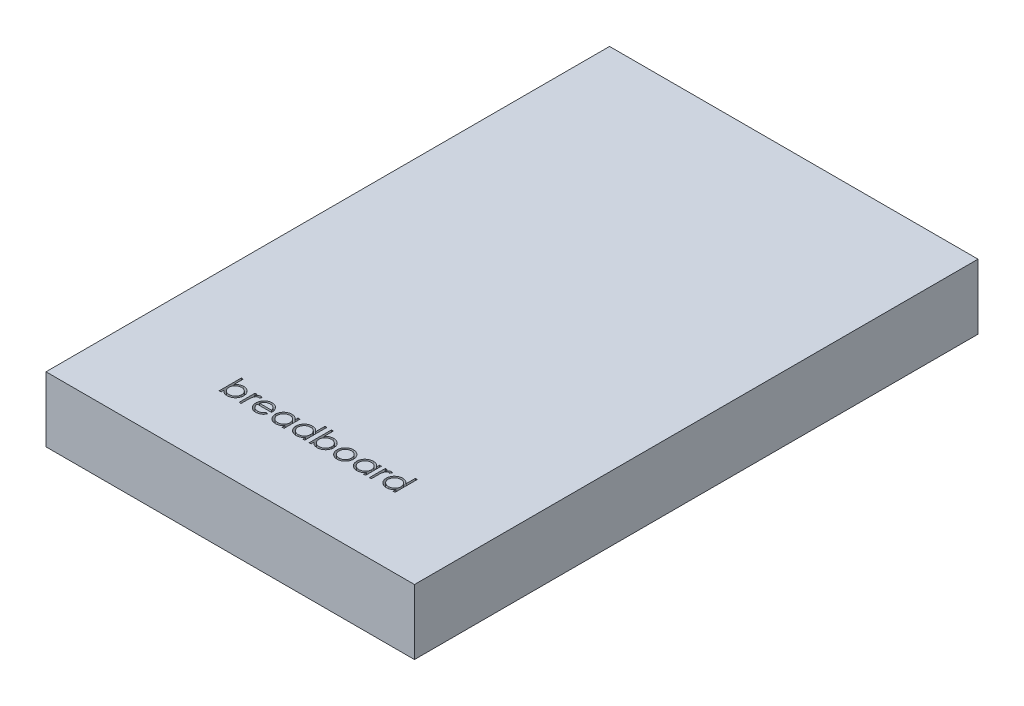
from build123d import *

# Parameters (mm, degrees)
SKETCH1_W           = 53.975
SKETCH1_H           = 82.55
BOSS_EXTRUDE1_DEPTH = 9.525
CUT_EXTRUDE1_DEPTH  = 1.905


with BuildPart() as part:
    # Sketch1 → Boss-Extrude1 (new body)
    with BuildSketch(Plane(origin=(0, 0, 0), x_dir=(1, 0, 0), z_dir=(0, 1, 0))):
        with Locations((26.9875, 41.275)):
            Rectangle(SKETCH1_W, SKETCH1_H)
    extrude(amount=BOSS_EXTRUDE1_DEPTH)

    # Sketch2 → Cut-Extrude1 (cut)
    # profile 1 of 10: a face of its own
    with BuildSketch(Plane(origin=(0, 9.525, 0), x_dir=(1, 0, 0), z_dir=(0, 1, 0))):
        with BuildLine():
            Line((15.092649327, 10.264986523), (15.092649327, 13.52139678))
            Line((15.092649327, 13.52139678), (15.377585225, 13.52139678))
            Line((15.377585225, 13.52139678), (15.377585225, 12.164135161))
            add(Edge.make_bspline(
                [(15.377585225, 12.164135161), (15.409692112, 12.201108428), (15.472333973, 12.273244796), (15.577359753, 12.367449449), (15.687491949, 12.447325625), (15.803568366, 12.513171604), (15.925754099, 12.563312662), (16.053418226, 12.599981544), (16.186887098, 12.622103949), (16.27789092, 12.624613173), (16.323979456, 12.625883959)],
                knots=[0, 0, 0, 0, 1.077089805, 2.101446609, 3.097517232, 4.067117542, 5.031729543, 5.997785507, 6.985986182, 8, 8, 8, 8], degree=3))
            add(Edge.make_bspline(
                [(16.323979456, 12.625883959), (16.364951595, 12.624758895), (16.445960497, 12.622534452), (16.565052159, 12.605630302), (16.679636344, 12.578218439), (16.789650682, 12.540216248), (16.894581831, 12.489794547), (16.995328261, 12.429432075), (17.091373811, 12.357551591), (17.181230743, 12.27536598), (17.26404734, 12.186142472), (17.336539403, 12.090728901), (17.39777127, 11.990512212), (17.448418228, 11.885827869), (17.487580541, 11.776248322), (17.514561026, 11.661881013), (17.531700097, 11.542838454), (17.53385932, 11.461818982), (17.53495702, 11.420630554)],
                knots=[0, 0, 0, 0, 1.034377878, 2.045141349, 3.03070803, 4.00595497, 4.978199603, 5.965204761, 6.967410914, 8.002051993, 9.036360596, 10.037508045, 11.022711142, 11.997267194, 12.969246472, 13.954813154, 14.960274251, 16, 16, 16, 16], degree=3))
            add(Edge.make_bspline(
                [(17.53495702, 11.420630554), (17.533835392, 11.380081252), (17.531623717, 11.300124415), (17.514731531, 11.182462039), (17.486840276, 11.069215505), (17.446961203, 10.960677443), (17.396828009, 10.85633795), (17.334134208, 10.75738644), (17.26173423, 10.662101084), (17.177976689, 10.573542504), (17.087340823, 10.49168792), (16.990354331, 10.420562599), (16.889460159, 10.359133497), (16.783085764, 10.310460341), (16.672806184, 10.271089506), (16.55743994, 10.243768457), (16.437639726, 10.227827186), (16.356251877, 10.225472636), (16.315075209, 10.224281395)],
                knots=[0, 0, 0, 0, 1.024244038, 2.01964794, 2.996620209, 3.965911562, 4.936179293, 5.91563013, 6.920572822, 7.955171681, 8.990768464, 10.002129126, 10.989675881, 11.969873457, 12.952483066, 13.943799762, 14.959703725, 16, 16, 16, 16], degree=3))
            add(Edge.make_bspline(
                [(16.315075209, 10.224281395), (16.267935428, 10.225588233), (16.175502538, 10.228150713), (16.040290478, 10.249395073), (15.912309358, 10.285555248), (15.790101296, 10.334143412), (15.67541329, 10.399937262), (15.567517191, 10.481540886), (15.467093417, 10.580298931), (15.407932449, 10.655647568), (15.377585225, 10.694298422)],
                knots=[0, 0, 0, 0, 1.035807596, 2.031038093, 2.998900396, 3.954262848, 4.914341711, 5.895762244, 6.92060972, 8, 8, 8, 8], degree=3))
            Line((15.377585225, 10.694298422), (15.377585225, 10.264986523))
            Line((15.377585225, 10.264986523), (15.092649327, 10.264986523))
        make_face()
        with BuildLine():
            add(Edge.make_bspline(
                [(16.312531138, 10.509217293), (16.354182015, 10.510699227), (16.436394221, 10.513624331), (16.557083946, 10.536460403), (16.672576121, 10.574455278), (16.782288774, 10.626419785), (16.884505008, 10.691754059), (16.975811326, 10.770808085), (17.056982205, 10.861070174), (17.12470203, 10.962882167), (17.181240838, 11.07124126), (17.220078595, 11.185227662), (17.246131485, 11.301790792), (17.248718928, 11.380844704), (17.250021122, 11.420630554)],
                knots=[0, 0, 0, 0, 1.031910345, 2.036826888, 3.032245421, 4.038315463, 5.03827337, 6.029480047, 7.023177075, 8.037597977, 9.052889626, 10.043399556, 11.015292101, 12, 12, 12, 12], degree=3))
            add(Edge.make_bspline(
                [(17.250021122, 11.420630554), (17.248308669, 11.46037751), (17.244890599, 11.539712741), (17.220964903, 11.657323511), (17.179183908, 11.771249428), (17.12374113, 11.881175174), (17.054918029, 11.983689393), (16.974176905, 12.075755437), (16.881755552, 12.155184851), (16.779408593, 12.221397273), (16.670387991, 12.275426296), (16.555642917, 12.312478569), (16.437570905, 12.336733925), (16.357383565, 12.339536206), (16.316983262, 12.340948062)],
                knots=[0, 0, 0, 0, 0.984795267, 1.965658976, 2.959410029, 3.983795688, 5.009594896, 6.01088574, 7.009236619, 8.019050059, 9.024672985, 10.014834719, 10.999826153, 12, 12, 12, 12], degree=3))
            add(Edge.make_bspline(
                [(16.316983262, 12.340948062), (16.275737737, 12.339537004), (16.19387374, 12.336736339), (16.073071138, 12.312435956), (15.955085159, 12.275199908), (15.842338613, 12.221740756), (15.737242434, 12.156325359), (15.643250993, 12.079453893), (15.562214508, 11.99166069), (15.495499802, 11.893230427), (15.442518306, 11.786926859), (15.404614477, 11.673522932), (15.381936226, 11.553615599), (15.379053206, 11.471398333), (15.377585225, 11.429534801)],
                knots=[0, 0, 0, 0, 1.016820015, 2.018181405, 3.029022337, 4.06341356, 5.088169224, 6.076823655, 7.05054209, 8.02560866, 9.001194327, 9.972267242, 10.967515442, 12, 12, 12, 12], degree=3))
            add(Edge.make_bspline(
                [(15.377585225, 11.429534801), (15.378455783, 11.397478351), (15.380169317, 11.334381114), (15.393259723, 11.241736709), (15.414083787, 11.153078832), (15.443423957, 11.068310872), (15.481978648, 10.98791403), (15.528433675, 10.911264015), (15.583725526, 10.83905247), (15.646233646, 10.771456429), (15.715142377, 10.709943603), (15.789095492, 10.656623356), (15.866581758, 10.610709055), (15.94848766, 10.574110519), (16.033860045, 10.544241461), (16.123574969, 10.524525849), (16.216712618, 10.51094135), (16.280255342, 10.509798029), (16.312531138, 10.509217293)],
                knots=[0, 0, 0, 0, 1.050331198, 2.067384183, 3.060053655, 4.031335885, 5.001026174, 5.976994447, 6.963687968, 7.976578778, 8.990422448, 9.985569286, 10.960374351, 11.936812464, 12.921228065, 13.919088064, 14.943024695, 16, 16, 16, 16], degree=3))
        make_face(mode=Mode.SUBTRACT)
    # profile 2 of 10: a face of its own
    with BuildSketch(Plane(origin=(0, 9.525, 0), x_dir=(1, 0, 0), z_dir=(0, 1, 0))):
        with BuildLine():
            Line((18.023418558, 12.585178831), (18.308354456, 12.585178831))
            Line((18.308354456, 12.585178831), (18.308354456, 12.243637365))
            add(Edge.make_bspline(
                [(18.308354456, 12.243637365), (18.329389972, 12.275438009), (18.369620235, 12.336256494), (18.436488392, 12.416692217), (18.5049807, 12.483290152), (18.575425049, 12.536361201), (18.648339468, 12.576105959), (18.722123702, 12.605218927), (18.797938593, 12.622434063), (18.848885481, 12.624732453), (18.874410145, 12.625883959)],
                knots=[0, 0, 0, 0, 1.2804753, 2.448899062, 3.506932113, 4.484331642, 5.4025378, 6.288909075, 7.142734305, 8, 8, 8, 8], degree=3))
            add(Edge.make_bspline(
                [(18.874410145, 12.625883959), (18.894209741, 12.624803982), (18.934948697, 12.622581857), (18.996618617, 12.606969181), (19.060158035, 12.582042689), (19.101108629, 12.558601915), (19.12245702, 12.546381756)],
                knots=[0, 0, 0, 0, 0.901110191, 1.854092781, 2.881294221, 4, 4, 4, 4], degree=3))
            Line((19.12245702, 12.546381756), (18.965996683, 12.299606916))
            add(Edge.make_bspline(
                [(18.965996683, 12.299606916), (18.952290643, 12.3057213), (18.926273954, 12.317327572), (18.888215169, 12.331063539), (18.85312567, 12.339151548), (18.830770442, 12.340376842), (18.820348646, 12.340948062)],
                knots=[0, 0, 0, 0, 1.180555205, 2.24091978, 3.179933427, 4, 4, 4, 4], degree=3))
            add(Edge.make_bspline(
                [(18.820348646, 12.340948062), (18.797483445, 12.339424028), (18.750845063, 12.336315441), (18.682369838, 12.311878094), (18.615924159, 12.272394483), (18.563154151, 12.228605689), (18.522294393, 12.186380187), (18.493138617, 12.149506279), (18.466393554, 12.108159949), (18.44083914, 12.063048021), (18.417556144, 12.013400232), (18.395825837, 11.959712603), (18.376178154, 11.90192295), (18.364974718, 11.861661664), (18.359235866, 11.841038206)],
                knots=[0, 0, 0, 0, 1.125678352, 2.296057538, 3.5422874, 4.923748041, 5.663163013, 6.437101912, 7.23742474, 8.08941207, 8.991984279, 9.93940061, 10.944477711, 12, 12, 12, 12], degree=3))
            add(Edge.make_bspline(
                [(18.359235866, 11.841038206), (18.354942909, 11.822643913), (18.345434336, 11.781901951), (18.336189155, 11.713550075), (18.327054664, 11.632792899), (18.320617017, 11.539405633), (18.314649793, 11.433621487), (18.311284219, 11.315279308), (18.308469227, 11.184257625), (18.308393873, 11.092659462), (18.308354456, 11.044744136)],
                knots=[0, 0, 0, 0, 0.566838948, 1.255505196, 2.06880316, 3.007127437, 4.065329342, 5.249902469, 6.561414163, 8, 8, 8, 8], degree=3))
            Line((18.308354456, 11.044744136), (18.308354456, 10.264986523))
            Line((18.308354456, 10.264986523), (18.023418558, 10.264986523))
            Line((18.023418558, 10.264986523), (18.023418558, 12.585178831))
        make_face()
    # profile 3 of 10: a face of its own
    with BuildSketch(Plane(origin=(0, 9.525, 0), x_dir=(1, 0, 0), z_dir=(0, 1, 0))):
        with BuildLine():
            Line((21.311629696, 10.997678831), (21.564764712, 10.864751147))
            add(Edge.make_bspline(
                [(21.564764712, 10.864751147), (21.544592943, 10.828970411), (21.50534667, 10.759355267), (21.437854563, 10.663713508), (21.367104611, 10.57767308), (21.289903155, 10.503532608), (21.208559946, 10.438897423), (21.122623895, 10.382348111), (21.03164761, 10.334162024), (20.935626788, 10.293565088), (20.833755053, 10.262350762), (20.725785534, 10.240303361), (20.611511392, 10.22667511), (20.533183072, 10.225092018), (20.493075008, 10.224281395)],
                knots=[0, 0, 0, 0, 1.120438281, 2.179929193, 3.190490725, 4.156257408, 5.095198341, 6.022838206, 6.959905092, 7.901321166, 8.864066838, 9.862729781, 10.905609505, 12, 12, 12, 12], degree=3))
            add(Edge.make_bspline(
                [(20.493075008, 10.224281395), (20.448496215, 10.225322047), (20.361535902, 10.227352058), (20.234953417, 10.244853079), (20.115773516, 10.273403004), (20.0040029, 10.313286031), (19.899915285, 10.365380818), (19.803303795, 10.428844062), (19.713660368, 10.50334975), (19.633809836, 10.589543238), (19.561924313, 10.6817833), (19.498491605, 10.777900423), (19.445462364, 10.877652777), (19.402325354, 10.980405324), (19.367486655, 11.085510427), (19.34320543, 11.193924401), (19.329208445, 11.305353824), (19.327063555, 11.380734979), (19.325982661, 11.418722501)],
                knots=[0, 0, 0, 0, 1.145258523, 2.234067595, 3.276747158, 4.290159414, 5.277019952, 6.260822364, 7.254936242, 8.264827045, 9.274100331, 10.257902744, 11.220704747, 12.172965371, 13.118907548, 14.062713208, 15.023725156, 16, 16, 16, 16], degree=3))
            add(Edge.make_bspline(
                [(19.325982661, 11.418722501), (19.326943453, 11.454368526), (19.328847617, 11.525014239), (19.340849831, 11.629576555), (19.362120783, 11.731202365), (19.391309305, 11.829976115), (19.429002222, 11.925732422), (19.475114306, 12.018529565), (19.529717392, 12.108268799), (19.571874746, 12.164877356), (19.593110065, 12.193391972)],
                knots=[0, 0, 0, 0, 1.024358464, 2.0301432, 3.019427413, 4.004406732, 4.986367066, 5.972626655, 6.978780325, 8, 8, 8, 8], degree=3))
            add(Edge.make_bspline(
                [(19.593110065, 12.193391972), (19.621873463, 12.227744447), (19.678489107, 12.295361198), (19.774243801, 12.384205251), (19.877930407, 12.458630675), (19.988249525, 12.520322863), (20.106483327, 12.567198243), (20.231042469, 12.602130121), (20.363345251, 12.62170446), (20.45379213, 12.62446928), (20.500071202, 12.625883959)],
                knots=[0, 0, 0, 0, 1.030682036, 2.02871468, 2.997146059, 3.962720338, 4.930598197, 5.918074684, 6.934738563, 8, 8, 8, 8], degree=3))
            add(Edge.make_bspline(
                [(20.500071202, 12.625883959), (20.547648673, 12.624655644), (20.640984825, 12.622245968), (20.777085392, 12.599906366), (20.905864042, 12.56448012), (21.027269242, 12.514447753), (21.141313301, 12.449895873), (21.247254932, 12.369938631), (21.346905947, 12.277030795), (21.404880158, 12.205581312), (21.434381098, 12.169223302)],
                knots=[0, 0, 0, 0, 1.056321875, 2.072262726, 3.055038591, 4.01806755, 4.982017516, 5.957941055, 6.960871419, 8, 8, 8, 8], degree=3))
            add(Edge.make_bspline(
                [(21.434381098, 12.169223302), (21.454453392, 12.141824339), (21.494464373, 12.087208789), (21.544581385, 11.998153525), (21.588085594, 11.904980343), (21.622859065, 11.806183145), (21.651016327, 11.702932525), (21.67138787, 11.59449036), (21.683334595, 11.48088894), (21.685682914, 11.403485565), (21.686880097, 11.364024985)],
                knots=[0, 0, 0, 0, 0.94817472, 1.890038105, 2.849395472, 3.817997239, 4.812318967, 5.836947057, 6.897266129, 8, 8, 8, 8], degree=3))
            Line((21.686880097, 11.364024985), (19.610918558, 11.364024985))
            add(Edge.make_bspline(
                [(19.610918558, 11.364024985), (19.612315201, 11.33345385), (19.615061643, 11.273336945), (19.627866095, 11.185370592), (19.648048911, 11.101574774), (19.676414418, 11.022578014), (19.710765056, 10.947348542), (19.752843527, 10.876444408), (19.803044408, 10.810188572), (19.859038436, 10.747988382), (19.921365587, 10.692597549), (19.986936364, 10.643020581), (20.056689813, 10.601468361), (20.130075931, 10.567740889), (20.206976051, 10.541337303), (20.287414399, 10.523314351), (20.37123269, 10.511242904), (20.428369749, 10.509900636), (20.457458021, 10.509217293)],
                knots=[0, 0, 0, 0, 1.094153842, 2.151609401, 3.174256925, 4.172055639, 5.149267565, 6.128595816, 7.11444997, 8.118368179, 9.117203808, 10.09244225, 11.054858984, 12.015122123, 12.976791628, 13.957293641, 14.960065497, 16, 16, 16, 16], degree=3))
            add(Edge.make_bspline(
                [(20.457458021, 10.509217293), (20.485897991, 10.509768887), (20.542328346, 10.510863356), (20.626366838, 10.521505875), (20.70904341, 10.538714625), (20.790015873, 10.562200545), (20.867640855, 10.59084526), (20.939527889, 10.625409996), (21.005640656, 10.663645837), (21.067432476, 10.7073789), (21.127368306, 10.760907755), (21.186824704, 10.827705873), (21.250575668, 10.906706702), (21.290480513, 10.966165985), (21.311629696, 10.997678831)],
                knots=[0, 0, 0, 0, 0.99110716, 1.966546729, 2.947904876, 3.932708344, 4.903319531, 5.828989031, 6.710028674, 7.56322171, 8.463672341, 9.504779593, 10.677557249, 12, 12, 12, 12], degree=3))
        make_face()
        with BuildLine():
            add(Edge.make_bspline(
                [(21.401944199, 11.648960882), (21.391515118, 11.686755061), (21.371442495, 11.759496688), (21.329499507, 11.860226639), (21.282263181, 11.949750663), (21.226363467, 12.027383616), (21.163027909, 12.09632966), (21.089871208, 12.156580805), (21.007832933, 12.210480921), (20.917337141, 12.255976403), (20.82150495, 12.294702203), (20.721169333, 12.320669273), (20.618791197, 12.338457929), (20.549545095, 12.34011447), (20.514699608, 12.340948062)],
                knots=[0, 0, 0, 0, 1.154881502, 2.222775134, 3.210006277, 4.132804581, 5.035138423, 5.962687519, 6.919655026, 7.923214229, 8.944639381, 9.960483929, 10.97369054, 12, 12, 12, 12], degree=3))
            add(Edge.make_bspline(
                [(20.514699608, 12.340948062), (20.486261189, 12.340393188), (20.430044413, 12.33929632), (20.347221301, 12.328891274), (20.267683288, 12.311691986), (20.190843492, 12.288138062), (20.117708847, 12.256743115), (20.046775021, 12.219928331), (19.979845662, 12.174987037), (19.937988915, 12.140734362), (19.916843037, 12.123430033)],
                knots=[0, 0, 0, 0, 1.04873581, 2.073130211, 3.073294108, 4.04793562, 5.032784715, 6.005352987, 6.992311501, 8, 8, 8, 8], degree=3))
            add(Edge.make_bspline(
                [(19.916843037, 12.123430033), (19.901699846, 12.109737332), (19.871053717, 12.082026644), (19.830104815, 12.034284435), (19.790897672, 11.982802661), (19.75521643, 11.925611726), (19.722488905, 11.863362877), (19.691863783, 11.796581165), (19.664298966, 11.724759825), (19.648790352, 11.674710541), (19.640811387, 11.648960882)],
                knots=[0, 0, 0, 0, 0.879870761, 1.780643979, 2.707998968, 3.669668524, 4.684282772, 5.740141944, 6.837334558, 8, 8, 8, 8], degree=3))
            Line((19.640811387, 11.648960882), (21.401944199, 11.648960882))
        make_face(mode=Mode.SUBTRACT)
    # profile 4 of 10: a face of its own
    with BuildSketch(Plane(origin=(0, 9.525, 0), x_dir=(1, 0, 0), z_dir=(0, 1, 0))):
        with BuildLine():
            Line((24.617649327, 12.585178831), (24.617649327, 10.264986523))
            Line((24.617649327, 10.264986523), (24.33271343, 10.264986523))
            Line((24.33271343, 10.264986523), (24.33271343, 10.666313647))
            add(Edge.make_bspline(
                [(24.33271343, 10.666313647), (24.300583527, 10.629992015), (24.237881617, 10.559109894), (24.133160032, 10.466506781), (24.022154613, 10.389963589), (23.905404129, 10.32814188), (23.783014008, 10.281703371), (23.655255558, 10.248695927), (23.522076662, 10.227474377), (23.431133455, 10.225355271), (23.385047164, 10.224281395)],
                knots=[0, 0, 0, 0, 1.074387032, 2.096679803, 3.090159297, 4.057316773, 5.018401886, 5.985159533, 6.978961417, 8, 8, 8, 8], degree=3))
            add(Edge.make_bspline(
                [(23.385047164, 10.224281395), (23.344073377, 10.22539389), (23.263271256, 10.227587779), (23.144409164, 10.244607869), (23.030025481, 10.271940647), (22.920012118, 10.30995074), (22.815080958, 10.360370485), (22.714333585, 10.420732903), (22.618291928, 10.492615656), (22.528419889, 10.574791939), (22.445659432, 10.664050249), (22.37303242, 10.759250852), (22.312477841, 10.859982085), (22.261841053, 10.964968589), (22.222837226, 11.075018551), (22.195646858, 11.189751411), (22.178646596, 11.30903151), (22.176453614, 11.390256649), (22.175341635, 11.431442854)],
                knots=[0, 0, 0, 0, 1.033919861, 2.038935746, 3.024066025, 3.998881131, 4.97069526, 5.957263378, 6.95902576, 7.993208707, 9.027059324, 10.027763471, 11.009749337, 11.988697705, 12.965288445, 13.950418724, 14.960734635, 16, 16, 16, 16], degree=3))
            add(Edge.make_bspline(
                [(22.175341635, 11.431442854), (22.176478259, 11.471777785), (22.178725304, 11.551517768), (22.19546501, 11.668792015), (22.223614568, 11.781747866), (22.263118687, 11.890021664), (22.313775317, 11.993744424), (22.375395796, 12.092989504), (22.447984574, 12.188030314), (22.531670686, 12.27663207), (22.622325799, 12.358475056), (22.71930729, 12.429603262), (22.820202696, 12.491032117), (22.926576998, 12.539703485), (23.036855729, 12.579081744), (23.15202064, 12.606325937), (23.271592572, 12.622379935), (23.352773233, 12.624704728), (23.393951411, 12.625883959)],
                knots=[0, 0, 0, 0, 1.020392517, 2.01726096, 2.990465484, 3.961182959, 4.928053699, 5.906110375, 6.912531644, 7.948652711, 8.985773172, 9.998621852, 10.987621588, 11.969261332, 12.953316658, 13.946091881, 14.958173133, 16, 16, 16, 16], degree=3))
            add(Edge.make_bspline(
                [(23.393951411, 12.625883959), (23.44130414, 12.624579713), (23.534160607, 12.622022148), (23.669985301, 12.600738103), (23.798477078, 12.564780351), (23.920627811, 12.515869477), (24.035998862, 12.450873845), (24.143497998, 12.368886308), (24.244250258, 12.270423946), (24.30265238, 12.194795043), (24.33271343, 12.155866932)],
                knots=[0, 0, 0, 0, 1.038897134, 2.037228247, 3.008116434, 3.962042015, 4.918381754, 5.904844433, 6.921570401, 8, 8, 8, 8], degree=3))
            Line((24.33271343, 12.155866932), (24.33271343, 12.585178831))
            Line((24.33271343, 12.585178831), (24.617649327, 12.585178831))
        make_face()
        with BuildLine():
            add(Edge.make_bspline(
                [(23.397767516, 12.340948062), (23.356116653, 12.339466119), (23.273904473, 12.336541), (23.153214557, 12.313705043), (23.037723103, 12.275709733), (22.928007735, 12.223746865), (22.825801567, 12.158406511), (22.734458023, 12.079374971), (22.653230001, 11.988808537), (22.584914647, 11.887115908), (22.529224696, 11.778097211), (22.490066032, 11.664137899), (22.464240357, 11.547293384), (22.461601913, 11.468042947), (22.460277533, 11.428262765)],
                knots=[0, 0, 0, 0, 1.031046209, 2.035121221, 3.029706178, 4.034933723, 5.034054252, 6.02443088, 7.017295772, 8.038157696, 9.050218397, 10.03989886, 11.016116709, 12, 12, 12, 12], degree=3))
            add(Edge.make_bspline(
                [(22.460277533, 11.428262765), (22.461969257, 11.388720311), (22.465346075, 11.309790395), (22.489612777, 11.192786586), (22.530325233, 11.07880042), (22.585880533, 10.968799376), (22.655446257, 10.866669513), (22.736080963, 10.774376688), (22.828564433, 10.695011133), (22.931005814, 10.628574191), (23.040414473, 10.574905333), (23.155470968, 10.537562217), (23.27401244, 10.513452373), (23.3546142, 10.510636169), (23.395223446, 10.509217293)],
                knots=[0, 0, 0, 0, 0.979072187, 1.954306742, 2.945804271, 3.96968567, 4.997920485, 5.998718438, 6.996577872, 8.005894225, 9.015743152, 10.005417472, 10.995077863, 12, 12, 12, 12], degree=3))
            add(Edge.make_bspline(
                [(23.395223446, 10.509217293), (23.436449916, 10.510723117), (23.518445277, 10.513718053), (23.639493248, 10.536651772), (23.756963678, 10.574542039), (23.869256378, 10.627064818), (23.973864583, 10.692158991), (24.067751943, 10.768365424), (24.147141429, 10.856996169), (24.214444725, 10.954401952), (24.267218139, 11.061183548), (24.305659278, 11.174879564), (24.32838675, 11.295493957), (24.331251261, 11.377920519), (24.33271343, 11.419994536)],
                knots=[0, 0, 0, 0, 1.01762866, 2.023962475, 3.030623092, 4.058876274, 5.077231937, 6.066672613, 7.034107872, 8.005628644, 8.981990164, 9.965428785, 10.961468474, 12, 12, 12, 12], degree=3))
            add(Edge.make_bspline(
                [(24.33271343, 11.419994536), (24.331842885, 11.452050997), (24.330129376, 11.515148256), (24.317038788, 11.607792504), (24.29621539, 11.696450955), (24.266872793, 11.781216823), (24.228327128, 11.861621444), (24.181838083, 11.938242141), (24.126588139, 12.010680411), (24.063466694, 12.077938769), (23.994373974, 12.139285631), (23.921263212, 12.194044621), (23.843268206, 12.239028722), (23.761700608, 12.276259018), (23.676418898, 12.305885532), (23.586729121, 12.325650083), (23.493584612, 12.339221232), (23.430042833, 12.340366391), (23.397767516, 12.340948062)],
                knots=[0, 0, 0, 0, 1.050140795, 2.067009409, 3.05949893, 4.030605086, 5.00011959, 5.97591094, 6.962425594, 7.979863591, 8.993523472, 9.986985069, 10.967611495, 11.937549037, 12.921786183, 13.919465291, 14.943216303, 16, 16, 16, 16], degree=3))
        make_face(mode=Mode.SUBTRACT)
    # profile 5 of 10: a face of its own
    with BuildSketch(Plane(origin=(0, 9.525, 0), x_dir=(1, 0, 0), z_dir=(0, 1, 0))):
        with BuildLine():
            Line((27.629828815, 13.52139678), (27.629828815, 10.264986523))
            Line((27.629828815, 10.264986523), (27.344892917, 10.264986523))
            Line((27.344892917, 10.264986523), (27.344892917, 10.666313647))
            add(Edge.make_bspline(
                [(27.344892917, 10.666313647), (27.312763014, 10.629992015), (27.250061105, 10.559109894), (27.145339519, 10.466506781), (27.034334101, 10.389963589), (26.917583616, 10.32814188), (26.795193496, 10.281703371), (26.667435045, 10.248695927), (26.53425615, 10.227474377), (26.443312942, 10.225355271), (26.397226651, 10.224281395)],
                knots=[0, 0, 0, 0, 1.074387032, 2.096679803, 3.090159297, 4.057316773, 5.018401886, 5.985159533, 6.978961417, 8, 8, 8, 8], degree=3))
            add(Edge.make_bspline(
                [(26.397226651, 10.224281395), (26.356252864, 10.22539389), (26.275450743, 10.227587779), (26.156588651, 10.244607869), (26.042204968, 10.271940647), (25.932191606, 10.30995074), (25.827260445, 10.360370485), (25.726513072, 10.420732903), (25.630471415, 10.492615656), (25.540599377, 10.574791939), (25.457838919, 10.664050249), (25.385211907, 10.759250852), (25.324657328, 10.859982085), (25.27402054, 10.964968589), (25.235016714, 11.075018551), (25.207826345, 11.189751411), (25.190826083, 11.30903151), (25.188633101, 11.390256649), (25.187521122, 11.431442854)],
                knots=[0, 0, 0, 0, 1.033919861, 2.038935746, 3.024066025, 3.998881131, 4.97069526, 5.957263378, 6.95902576, 7.993208707, 9.027059324, 10.027763471, 11.009749337, 11.988697705, 12.965288445, 13.950418724, 14.960734635, 16, 16, 16, 16], degree=3))
            add(Edge.make_bspline(
                [(25.187521122, 11.431442854), (25.188657746, 11.471777785), (25.190904791, 11.551517768), (25.207644497, 11.668792015), (25.235794055, 11.781747866), (25.275298174, 11.890021664), (25.325954805, 11.993744424), (25.387575284, 12.092989504), (25.460164061, 12.188030314), (25.543850173, 12.27663207), (25.634505286, 12.358475056), (25.731486778, 12.429603262), (25.832382183, 12.491032117), (25.938756485, 12.539703485), (26.049035216, 12.579081744), (26.164200128, 12.606325937), (26.28377206, 12.622379935), (26.36495272, 12.624704728), (26.406130898, 12.625883959)],
                knots=[0, 0, 0, 0, 1.020392517, 2.01726096, 2.990465484, 3.961182959, 4.928053699, 5.906110375, 6.912531644, 7.948652711, 8.985773172, 9.998621852, 10.987621588, 11.969261332, 12.953316658, 13.946091881, 14.958173133, 16, 16, 16, 16], degree=3))
            add(Edge.make_bspline(
                [(26.406130898, 12.625883959), (26.453499002, 12.624462379), (26.546477326, 12.621671976), (26.6824567, 12.598352629), (26.811078318, 12.559197732), (26.933082671, 12.505593499), (27.047742407, 12.435924246), (27.155898003, 12.351785432), (27.255668589, 12.250795807), (27.314698028, 12.174948165), (27.344892917, 12.136150386)],
                knots=[0, 0, 0, 0, 1.031072012, 2.023879775, 2.993683497, 3.952812103, 4.918022106, 5.908088563, 6.929940113, 8, 8, 8, 8], degree=3))
            Line((27.344892917, 12.136150386), (27.344892917, 13.52139678))
            Line((27.344892917, 13.52139678), (27.629828815, 13.52139678))
        make_face()
        with BuildLine():
            add(Edge.make_bspline(
                [(26.409947004, 12.340948062), (26.36829614, 12.339466119), (26.28608396, 12.336541), (26.165394044, 12.313705043), (26.04990259, 12.275709733), (25.940187222, 12.223746865), (25.837981054, 12.158406511), (25.74663751, 12.079374971), (25.665409488, 11.988808537), (25.597094134, 11.887115908), (25.541404183, 11.778097211), (25.502245519, 11.664137899), (25.476419844, 11.547293384), (25.473781401, 11.468042947), (25.47245702, 11.428262765)],
                knots=[0, 0, 0, 0, 1.031046209, 2.035121221, 3.029706178, 4.034933723, 5.034054252, 6.02443088, 7.017295772, 8.038157696, 9.050218397, 10.03989886, 11.016116709, 12, 12, 12, 12], degree=3))
            add(Edge.make_bspline(
                [(25.47245702, 11.428262765), (25.474148744, 11.388720311), (25.477525563, 11.309790395), (25.501792264, 11.192786586), (25.542504721, 11.07880042), (25.59806002, 10.968799376), (25.667625744, 10.866669513), (25.74826045, 10.774376688), (25.84074392, 10.695011133), (25.943185301, 10.628574191), (26.05259396, 10.574905333), (26.167650455, 10.537562217), (26.286191927, 10.513452373), (26.366793687, 10.510636169), (26.407402933, 10.509217293)],
                knots=[0, 0, 0, 0, 0.979072187, 1.954306742, 2.945804271, 3.96968567, 4.997920485, 5.998718438, 6.996577872, 8.005894225, 9.015743152, 10.005417472, 10.995077863, 12, 12, 12, 12], degree=3))
            add(Edge.make_bspline(
                [(26.407402933, 10.509217293), (26.448629404, 10.510723117), (26.530624764, 10.513718053), (26.651672735, 10.536651772), (26.769143165, 10.574542039), (26.881435865, 10.627064818), (26.98604407, 10.692158991), (27.079931431, 10.768365424), (27.159320916, 10.856996169), (27.226624212, 10.954401952), (27.279397626, 11.061183548), (27.317838765, 11.174879564), (27.340566237, 11.295493957), (27.343430749, 11.377920519), (27.344892917, 11.419994536)],
                knots=[0, 0, 0, 0, 1.01762866, 2.023962475, 3.030623092, 4.058876274, 5.077231937, 6.066672613, 7.034107872, 8.005628644, 8.981990164, 9.965428785, 10.961468474, 12, 12, 12, 12], degree=3))
            add(Edge.make_bspline(
                [(27.344892917, 11.419994536), (27.344022372, 11.452050997), (27.342308863, 11.515148256), (27.329218275, 11.607792504), (27.308394877, 11.696450955), (27.27905228, 11.781216823), (27.240506615, 11.861621444), (27.19401757, 11.938242141), (27.138767627, 12.010680411), (27.075646181, 12.077938769), (27.006553461, 12.139285631), (26.933442699, 12.194044621), (26.855447693, 12.239028722), (26.773880096, 12.276259018), (26.688598385, 12.305885532), (26.598908608, 12.325650083), (26.505764099, 12.339221232), (26.44222232, 12.340366391), (26.409947004, 12.340948062)],
                knots=[0, 0, 0, 0, 1.050140795, 2.067009409, 3.05949893, 4.030605086, 5.00011959, 5.97591094, 6.962425594, 7.979863591, 8.993523472, 9.986985069, 10.967611495, 11.937549037, 12.921786183, 13.919465291, 14.943216303, 16, 16, 16, 16], degree=3))
        make_face(mode=Mode.SUBTRACT)
    # profile 6 of 10: a face of its own
    with BuildSketch(Plane(origin=(0, 9.525, 0), x_dir=(1, 0, 0), z_dir=(0, 1, 0))):
        with BuildLine():
            Line((28.281110866, 10.264986523), (28.281110866, 13.52139678))
            Line((28.281110866, 13.52139678), (28.566046763, 13.52139678))
            Line((28.566046763, 13.52139678), (28.566046763, 12.164135161))
            add(Edge.make_bspline(
                [(28.566046763, 12.164135161), (28.598153651, 12.201108428), (28.660795511, 12.273244796), (28.765821292, 12.367449449), (28.875953487, 12.447325625), (28.992029905, 12.513171604), (29.114215637, 12.563312662), (29.241879764, 12.599981544), (29.375348637, 12.622103949), (29.466352459, 12.624613173), (29.512440994, 12.625883959)],
                knots=[0, 0, 0, 0, 1.077089805, 2.101446609, 3.097517232, 4.067117542, 5.031729543, 5.997785507, 6.985986182, 8, 8, 8, 8], degree=3))
            add(Edge.make_bspline(
                [(29.512440994, 12.625883959), (29.553413133, 12.624758895), (29.634422035, 12.622534452), (29.753513698, 12.605630302), (29.868097883, 12.578218439), (29.97811222, 12.540216248), (30.083043369, 12.489794547), (30.1837898, 12.429432075), (30.27983535, 12.357551591), (30.369692282, 12.27536598), (30.452508878, 12.186142472), (30.525000941, 12.090728901), (30.586232808, 11.990512212), (30.636879767, 11.885827869), (30.676042079, 11.776248322), (30.703022564, 11.661881013), (30.720161635, 11.542838454), (30.722320859, 11.461818982), (30.723418558, 11.420630554)],
                knots=[0, 0, 0, 0, 1.034377878, 2.045141349, 3.03070803, 4.00595497, 4.978199603, 5.965204761, 6.967410914, 8.002051993, 9.036360596, 10.037508045, 11.022711142, 11.997267194, 12.969246472, 13.954813154, 14.960274251, 16, 16, 16, 16], degree=3))
            add(Edge.make_bspline(
                [(30.723418558, 11.420630554), (30.72229693, 11.380081252), (30.720085256, 11.300124415), (30.703193069, 11.182462039), (30.675301815, 11.069215505), (30.635422741, 10.960677443), (30.585289547, 10.85633795), (30.522595747, 10.75738644), (30.450195769, 10.662101084), (30.366438227, 10.573542504), (30.275802361, 10.49168792), (30.178815869, 10.420562599), (30.077921698, 10.359133497), (29.971547303, 10.310460341), (29.861267723, 10.271089506), (29.745901479, 10.243768457), (29.626101265, 10.227827186), (29.544713416, 10.225472636), (29.503536747, 10.224281395)],
                knots=[0, 0, 0, 0, 1.024244038, 2.01964794, 2.996620209, 3.965911562, 4.936179293, 5.91563013, 6.920572822, 7.955171681, 8.990768464, 10.002129126, 10.989675881, 11.969873457, 12.952483066, 13.943799762, 14.959703725, 16, 16, 16, 16], degree=3))
            add(Edge.make_bspline(
                [(29.503536747, 10.224281395), (29.456396967, 10.225588233), (29.363964077, 10.228150713), (29.228752016, 10.249395073), (29.100770896, 10.285555248), (28.978562835, 10.334143412), (28.863874829, 10.399937262), (28.755978729, 10.481540886), (28.655554955, 10.580298931), (28.596393987, 10.655647568), (28.566046763, 10.694298422)],
                knots=[0, 0, 0, 0, 1.035807596, 2.031038093, 2.998900396, 3.954262848, 4.914341711, 5.895762244, 6.92060972, 8, 8, 8, 8], degree=3))
            Line((28.566046763, 10.694298422), (28.566046763, 10.264986523))
            Line((28.566046763, 10.264986523), (28.281110866, 10.264986523))
        make_face()
        with BuildLine():
            add(Edge.make_bspline(
                [(29.500992677, 10.509217293), (29.542643554, 10.510699227), (29.62485576, 10.513624331), (29.745545484, 10.536460403), (29.86103766, 10.574455278), (29.970750313, 10.626419785), (30.072966546, 10.691754059), (30.164272864, 10.770808085), (30.245443743, 10.861070174), (30.313163569, 10.962882167), (30.369702376, 11.07124126), (30.408540134, 11.185227662), (30.434593024, 11.301790792), (30.437180466, 11.380844704), (30.438482661, 11.420630554)],
                knots=[0, 0, 0, 0, 1.031910345, 2.036826888, 3.032245421, 4.038315463, 5.03827337, 6.029480047, 7.023177075, 8.037597977, 9.052889626, 10.043399556, 11.015292101, 12, 12, 12, 12], degree=3))
            add(Edge.make_bspline(
                [(30.438482661, 11.420630554), (30.436770207, 11.46037751), (30.433352137, 11.539712741), (30.409426442, 11.657323511), (30.367645446, 11.771249428), (30.312202668, 11.881175174), (30.243379567, 11.983689393), (30.162638443, 12.075755437), (30.070217091, 12.155184851), (29.967870131, 12.221397273), (29.85884953, 12.275426296), (29.744104455, 12.312478569), (29.626032444, 12.336733925), (29.545845104, 12.339536206), (29.5054448, 12.340948062)],
                knots=[0, 0, 0, 0, 0.984795267, 1.965658976, 2.959410029, 3.983795688, 5.009594896, 6.01088574, 7.009236619, 8.019050059, 9.024672985, 10.014834719, 10.999826153, 12, 12, 12, 12], degree=3))
            add(Edge.make_bspline(
                [(29.5054448, 12.340948062), (29.464199276, 12.339537004), (29.382335278, 12.336736339), (29.261532677, 12.312435956), (29.143546698, 12.275199908), (29.030800151, 12.221740756), (28.925703972, 12.156325359), (28.831712531, 12.079453893), (28.750676047, 11.99166069), (28.68396134, 11.893230427), (28.630979844, 11.786926859), (28.593076016, 11.673522932), (28.570397765, 11.553615599), (28.567514745, 11.471398333), (28.566046763, 11.429534801)],
                knots=[0, 0, 0, 0, 1.016820015, 2.018181405, 3.029022337, 4.06341356, 5.088169224, 6.076823655, 7.05054209, 8.02560866, 9.001194327, 9.972267242, 10.967515442, 12, 12, 12, 12], degree=3))
            add(Edge.make_bspline(
                [(28.566046763, 11.429534801), (28.566917321, 11.397478351), (28.568630855, 11.334381114), (28.581721261, 11.241736709), (28.602545326, 11.153078832), (28.631885495, 11.068310872), (28.670440187, 10.98791403), (28.716895214, 10.911264015), (28.772187064, 10.83905247), (28.834695185, 10.771456429), (28.903603916, 10.709943603), (28.977557031, 10.656623356), (29.055043296, 10.610709055), (29.136949199, 10.574110519), (29.222321584, 10.544241461), (29.312036507, 10.524525849), (29.405174156, 10.51094135), (29.46871688, 10.509798029), (29.500992677, 10.509217293)],
                knots=[0, 0, 0, 0, 1.050331198, 2.067384183, 3.060053655, 4.031335885, 5.001026174, 5.976994447, 6.963687968, 7.976578778, 8.990422448, 9.985569286, 10.960374351, 11.936812464, 12.921228065, 13.919088064, 14.943024695, 16, 16, 16, 16], degree=3))
        make_face(mode=Mode.SUBTRACT)
    # profile 7 of 10: a face of its own
    with BuildSketch(Plane(origin=(0, 9.525, 0), x_dir=(1, 0, 0), z_dir=(0, 1, 0))):
        with BuildLine():
            add(Edge.make_bspline(
                [(32.413953414, 12.625883959), (32.457488354, 12.624956958), (32.542849733, 12.623139335), (32.667861172, 12.603712902), (32.787191403, 12.574006364), (32.901297448, 12.53293859), (33.008717945, 12.477891392), (33.111017574, 12.412205821), (33.20791586, 12.334388754), (33.265993894, 12.274192506), (33.295473847, 12.243637365)],
                knots=[0, 0, 0, 0, 1.054011418, 2.066658804, 3.057071809, 4.030435133, 4.997543892, 5.974964718, 6.972108034, 8, 8, 8, 8], degree=3))
            add(Edge.make_bspline(
                [(33.295473847, 12.243637365), (33.320857476, 12.214414678), (33.371133493, 12.156534843), (33.435600252, 12.062685823), (33.491136953, 11.965494446), (33.535644068, 11.863670085), (33.57073691, 11.758101633), (33.595652221, 11.648426238), (33.610472154, 11.534886108), (33.61247056, 11.457775484), (33.613482661, 11.418722501)],
                knots=[0, 0, 0, 0, 1.025258237, 2.030674902, 3.01204498, 3.988269485, 4.97094183, 5.956517959, 6.965070386, 8, 8, 8, 8], degree=3))
            add(Edge.make_bspline(
                [(33.613482661, 11.418722501), (33.612592448, 11.379443163), (33.610833345, 11.301825359), (33.594193064, 11.187507792), (33.568311294, 11.076659631), (33.531270983, 10.969744959), (33.483774698, 10.866436965), (33.425816718, 10.767186874), (33.356990322, 10.671798868), (33.278972411, 10.581082914), (33.19274678, 10.497474991), (33.099205703, 10.424605775), (33.000187401, 10.362174821), (32.894375216, 10.311886072), (32.782735424, 10.27223513), (32.665027227, 10.244385829), (32.541433484, 10.22754773), (32.457044505, 10.225385489), (32.413953414, 10.224281395)],
                knots=[0, 0, 0, 0, 0.998656419, 1.973391657, 2.932242238, 3.890759089, 4.846373663, 5.82037756, 6.809684879, 7.83454468, 8.860553229, 9.859544525, 10.845671541, 11.83227036, 12.833544569, 13.85385346, 14.904124723, 16, 16, 16, 16], degree=3))
            add(Edge.make_bspline(
                [(32.413953414, 10.224281395), (32.370651204, 10.225389195), (32.285841638, 10.227558876), (32.161811641, 10.244320411), (32.043892486, 10.272222295), (31.932106543, 10.312016378), (31.825839432, 10.362176428), (31.726247396, 10.424417032), (31.632630329, 10.497496602), (31.546386458, 10.581077059), (31.468373437, 10.671800376), (31.39954578, 10.767186483), (31.341588127, 10.866437067), (31.294091756, 10.969744932), (31.257051469, 11.076659638), (31.231169692, 11.18750779), (31.214529413, 11.30182536), (31.21277031, 11.379443163), (31.211880097, 11.418722501)],
                knots=[0, 0, 0, 0, 1.099876186, 2.154163076, 3.173186993, 4.173200201, 5.163417411, 6.152872554, 7.150605724, 8.17532212, 9.198891216, 10.186952605, 11.159729845, 12.11414092, 13.071450619, 14.029093627, 15.002601286, 16, 16, 16, 16], degree=3))
            add(Edge.make_bspline(
                [(31.211880097, 11.418722501), (31.2128991, 11.457563225), (31.21491655, 11.534461183), (31.229721584, 11.647787873), (31.254539703, 11.757277648), (31.289674612, 11.862438615), (31.334591964, 11.963816761), (31.389348275, 12.061248286), (31.454472635, 12.154672934), (31.504548691, 12.212477963), (31.529888911, 12.241729312)],
                knots=[0, 0, 0, 0, 1.031353054, 2.041901799, 3.029428768, 4.008703097, 4.981709435, 5.96992636, 6.972712378, 8, 8, 8, 8], degree=3))
            add(Edge.make_bspline(
                [(31.529888911, 12.241729312), (31.559324418, 12.272549435), (31.617214523, 12.333162631), (31.714595155, 12.41075285), (31.816643121, 12.477805288), (31.925250733, 12.531758712), (32.03926304, 12.574247939), (32.159204781, 12.603789513), (32.284640427, 12.623069342), (32.370419512, 12.624936404), (32.413953414, 12.625883959)],
                knots=[0, 0, 0, 0, 1.027980169, 2.021703884, 2.998553061, 3.971491411, 4.943284454, 5.930300938, 6.949603206, 8, 8, 8, 8], degree=3))
        make_face()
        with BuildLine():
            add(Edge.make_bspline(
                [(32.412681379, 12.340948062), (32.381895117, 12.340073039), (32.321117336, 12.338345583), (32.231655284, 12.325206612), (32.145531002, 12.304389948), (32.062581093, 12.274813411), (31.983085287, 12.236623696), (31.906967472, 12.189716826), (31.834003758, 12.134714073), (31.765621458, 12.071701506), (31.702863218, 12.002868419), (31.648001053, 11.929527407), (31.601351135, 11.852868079), (31.562488991, 11.772810716), (31.533544613, 11.688544026), (31.512523371, 11.601022311), (31.499396796, 11.510067254), (31.497685581, 11.448235473), (31.496815994, 11.416814448)],
                knots=[0, 0, 0, 0, 1.021534396, 2.016698045, 2.994645724, 3.958388632, 4.93408049, 5.916473867, 6.921342795, 7.962252576, 8.998418191, 10.008913653, 10.997312074, 11.973003931, 12.956656626, 13.948281152, 14.957379055, 16, 16, 16, 16], degree=3))
            add(Edge.make_bspline(
                [(31.496815994, 11.416814448), (31.498273613, 11.376217966), (31.501166713, 11.295641541), (31.524693677, 11.176977166), (31.564051231, 11.063056486), (31.617198264, 10.954547335), (31.683788191, 10.854151769), (31.762244315, 10.764642637), (31.851724615, 10.687366936), (31.95116244, 10.623249312), (32.058526714, 10.572304391), (32.172152091, 10.536201034), (32.290661864, 10.512731713), (32.371652241, 10.510399019), (32.412681379, 10.509217293)],
                knots=[0, 0, 0, 0, 1.016792936, 2.018143844, 3.017858371, 4.030088057, 5.03801393, 6.028138512, 7.003788237, 7.991172063, 8.984598303, 9.972568034, 10.972917682, 12, 12, 12, 12], degree=3))
            add(Edge.make_bspline(
                [(32.412681379, 10.509217293), (32.453708156, 10.510405904), (32.534693875, 10.51275219), (32.653038986, 10.536082834), (32.766353803, 10.572462583), (32.873606562, 10.623192016), (32.972999124, 10.687610421), (33.063122969, 10.764206277), (33.140909209, 10.854388842), (33.207433265, 10.954680315), (33.261450668, 11.062888263), (33.300624001, 11.176998191), (33.324207525, 11.295636187), (33.327092991, 11.376216172), (33.328546763, 11.416814448)],
                knots=[0, 0, 0, 0, 1.02726834, 2.027799167, 3.010890988, 4.004497153, 4.992059811, 5.971914811, 6.958719428, 7.966827853, 8.981595046, 9.981490638, 10.983022906, 12, 12, 12, 12], degree=3))
            add(Edge.make_bspline(
                [(33.328546763, 11.416814448), (33.327677475, 11.448235661), (33.32596685, 11.510067812), (33.312835989, 11.60102018), (33.291830607, 11.688551843), (33.262827783, 11.772781874), (33.224134499, 11.853075361), (33.176584979, 11.929302327), (33.121946835, 12.00312248), (33.058431304, 12.071478997), (32.990120382, 12.134738637), (32.917127098, 12.189738155), (32.841122153, 12.236417545), (32.761857296, 12.275140063), (32.678896752, 12.304120865), (32.592893142, 12.325326809), (32.503812793, 12.338290059), (32.443252804, 12.340056394), (32.412681379, 12.340948062)],
                knots=[0, 0, 0, 0, 1.042956736, 2.052379634, 3.044323526, 4.02829302, 5.004299113, 5.996692471, 7.007513377, 8.048758398, 9.090003419, 10.095195979, 11.07790575, 12.047570684, 13.018257071, 13.989683339, 14.985167495, 16, 16, 16, 16], degree=3))
        make_face(mode=Mode.SUBTRACT)
    # profile 8 of 10: a face of its own
    with BuildSketch(Plane(origin=(0, 9.525, 0), x_dir=(1, 0, 0), z_dir=(0, 1, 0))):
        with BuildLine():
            Line((36.544251891, 12.585178831), (36.544251891, 10.264986523))
            Line((36.544251891, 10.264986523), (36.259315994, 10.264986523))
            Line((36.259315994, 10.264986523), (36.259315994, 10.666313647))
            add(Edge.make_bspline(
                [(36.259315994, 10.666313647), (36.227186091, 10.629992015), (36.164484182, 10.559109894), (36.059762596, 10.466506781), (35.948757177, 10.389963589), (35.832006693, 10.32814188), (35.709616573, 10.281703371), (35.581858122, 10.248695927), (35.448679226, 10.227474377), (35.357736019, 10.225355271), (35.311649728, 10.224281395)],
                knots=[0, 0, 0, 0, 1.074387032, 2.096679803, 3.090159297, 4.057316773, 5.018401886, 5.985159533, 6.978961417, 8, 8, 8, 8], degree=3))
            add(Edge.make_bspline(
                [(35.311649728, 10.224281395), (35.270675941, 10.22539389), (35.18987382, 10.227587779), (35.071011728, 10.244607869), (34.956628045, 10.271940647), (34.846614683, 10.30995074), (34.741683522, 10.360370485), (34.640936149, 10.420732903), (34.544894492, 10.492615656), (34.455022453, 10.574791939), (34.372261996, 10.664050249), (34.299634984, 10.759250852), (34.239080405, 10.859982085), (34.188443617, 10.964968589), (34.149439791, 11.075018551), (34.122249422, 11.189751411), (34.10524916, 11.30903151), (34.103056178, 11.390256649), (34.101944199, 11.431442854)],
                knots=[0, 0, 0, 0, 1.033919861, 2.038935746, 3.024066025, 3.998881131, 4.97069526, 5.957263378, 6.95902576, 7.993208707, 9.027059324, 10.027763471, 11.009749337, 11.988697705, 12.965288445, 13.950418724, 14.960734635, 16, 16, 16, 16], degree=3))
            add(Edge.make_bspline(
                [(34.101944199, 11.431442854), (34.103080823, 11.471777785), (34.105327868, 11.551517768), (34.122067574, 11.668792015), (34.150217132, 11.781747866), (34.189721251, 11.890021664), (34.240377882, 11.993744424), (34.301998361, 12.092989504), (34.374587138, 12.188030314), (34.45827325, 12.27663207), (34.548928363, 12.358475056), (34.645909855, 12.429603262), (34.74680526, 12.491032117), (34.853179562, 12.539703485), (34.963458293, 12.579081744), (35.078623204, 12.606325937), (35.198195137, 12.622379935), (35.279375797, 12.624704728), (35.320553975, 12.625883959)],
                knots=[0, 0, 0, 0, 1.020392517, 2.01726096, 2.990465484, 3.961182959, 4.928053699, 5.906110375, 6.912531644, 7.948652711, 8.985773172, 9.998621852, 10.987621588, 11.969261332, 12.953316658, 13.946091881, 14.958173133, 16, 16, 16, 16], degree=3))
            add(Edge.make_bspline(
                [(35.320553975, 12.625883959), (35.367906704, 12.624579713), (35.460763171, 12.622022148), (35.596587866, 12.600738103), (35.725079642, 12.564780351), (35.847230376, 12.515869477), (35.962601426, 12.450873845), (36.070100562, 12.368886308), (36.170852822, 12.270423946), (36.229254944, 12.194795043), (36.259315994, 12.155866932)],
                knots=[0, 0, 0, 0, 1.038897134, 2.037228247, 3.008116434, 3.962042015, 4.918381754, 5.904844433, 6.921570401, 8, 8, 8, 8], degree=3))
            Line((36.259315994, 12.155866932), (36.259315994, 12.585178831))
            Line((36.259315994, 12.585178831), (36.544251891, 12.585178831))
        make_face()
        with BuildLine():
            add(Edge.make_bspline(
                [(35.324370081, 12.340948062), (35.282719217, 12.339466119), (35.200507037, 12.336541), (35.079817121, 12.313705043), (34.964325667, 12.275709733), (34.854610299, 12.223746865), (34.752404131, 12.158406511), (34.661060587, 12.079374971), (34.579832565, 11.988808537), (34.511517211, 11.887115908), (34.45582726, 11.778097211), (34.416668596, 11.664137899), (34.390842921, 11.547293384), (34.388204478, 11.468042947), (34.386880097, 11.428262765)],
                knots=[0, 0, 0, 0, 1.031046209, 2.035121221, 3.029706178, 4.034933723, 5.034054252, 6.02443088, 7.017295772, 8.038157696, 9.050218397, 10.03989886, 11.016116709, 12, 12, 12, 12], degree=3))
            add(Edge.make_bspline(
                [(34.386880097, 11.428262765), (34.388571821, 11.388720311), (34.39194864, 11.309790395), (34.416215341, 11.192786586), (34.456927798, 11.07880042), (34.512483097, 10.968799376), (34.582048821, 10.866669513), (34.662683527, 10.774376688), (34.755166997, 10.695011133), (34.857608378, 10.628574191), (34.967017037, 10.574905333), (35.082073532, 10.537562217), (35.200615004, 10.513452373), (35.281216764, 10.510636169), (35.32182601, 10.509217293)],
                knots=[0, 0, 0, 0, 0.979072187, 1.954306742, 2.945804271, 3.96968567, 4.997920485, 5.998718438, 6.996577872, 8.005894225, 9.015743152, 10.005417472, 10.995077863, 12, 12, 12, 12], degree=3))
            add(Edge.make_bspline(
                [(35.32182601, 10.509217293), (35.36305248, 10.510723117), (35.445047841, 10.513718053), (35.566095812, 10.536651772), (35.683566242, 10.574542039), (35.795858942, 10.627064818), (35.900467147, 10.692158991), (35.994354507, 10.768365424), (36.073743993, 10.856996169), (36.141047289, 10.954401952), (36.193820703, 11.061183548), (36.232261842, 11.174879564), (36.254989314, 11.295493957), (36.257853826, 11.377920519), (36.259315994, 11.419994536)],
                knots=[0, 0, 0, 0, 1.01762866, 2.023962475, 3.030623092, 4.058876274, 5.077231937, 6.066672613, 7.034107872, 8.005628644, 8.981990164, 9.965428785, 10.961468474, 12, 12, 12, 12], degree=3))
            add(Edge.make_bspline(
                [(36.259315994, 11.419994536), (36.258445449, 11.452050997), (36.25673194, 11.515148256), (36.243641352, 11.607792504), (36.222817954, 11.696450955), (36.193475357, 11.781216823), (36.154929692, 11.861621444), (36.108440647, 11.938242141), (36.053190703, 12.010680411), (35.990069258, 12.077938769), (35.920976538, 12.139285631), (35.847865776, 12.194044621), (35.76987077, 12.239028722), (35.688303172, 12.276259018), (35.603021462, 12.305885532), (35.513331685, 12.325650083), (35.420187176, 12.339221232), (35.356645397, 12.340366391), (35.324370081, 12.340948062)],
                knots=[0, 0, 0, 0, 1.050140795, 2.067009409, 3.05949893, 4.030605086, 5.00011959, 5.97591094, 6.962425594, 7.979863591, 8.993523472, 9.986985069, 10.967611495, 11.937549037, 12.921786183, 13.919465291, 14.943216303, 16, 16, 16, 16], degree=3))
        make_face(mode=Mode.SUBTRACT)
    # profile 9 of 10: a face of its own
    with BuildSketch(Plane(origin=(0, 9.525, 0), x_dir=(1, 0, 0), z_dir=(0, 1, 0))):
        with BuildLine():
            Line((37.114123686, 12.585178831), (37.399059584, 12.585178831))
            Line((37.399059584, 12.585178831), (37.399059584, 12.243637365))
            add(Edge.make_bspline(
                [(37.399059584, 12.243637365), (37.420095101, 12.275438009), (37.460325363, 12.336256494), (37.527193521, 12.416692217), (37.595685828, 12.483290152), (37.666130177, 12.536361201), (37.739044596, 12.576105959), (37.812828831, 12.605218927), (37.888643721, 12.622434063), (37.93959061, 12.624732453), (37.965115273, 12.625883959)],
                knots=[0, 0, 0, 0, 1.2804753, 2.448899062, 3.506932113, 4.484331642, 5.4025378, 6.288909075, 7.142734305, 8, 8, 8, 8], degree=3))
            add(Edge.make_bspline(
                [(37.965115273, 12.625883959), (37.984914869, 12.624803982), (38.025653825, 12.622581857), (38.087323746, 12.606969181), (38.150863163, 12.582042689), (38.191813757, 12.558601915), (38.213162148, 12.546381756)],
                knots=[0, 0, 0, 0, 0.901110191, 1.854092781, 2.881294221, 4, 4, 4, 4], degree=3))
            Line((38.213162148, 12.546381756), (38.056701811, 12.299606916))
            add(Edge.make_bspline(
                [(38.056701811, 12.299606916), (38.042995771, 12.3057213), (38.016979082, 12.317327572), (37.978920297, 12.331063539), (37.943830798, 12.339151548), (37.92147557, 12.340376842), (37.911053775, 12.340948062)],
                knots=[0, 0, 0, 0, 1.180555205, 2.24091978, 3.179933427, 4, 4, 4, 4], degree=3))
            add(Edge.make_bspline(
                [(37.911053775, 12.340948062), (37.888188573, 12.339424028), (37.841550191, 12.336315441), (37.773074967, 12.311878094), (37.706629287, 12.272394483), (37.653859279, 12.228605689), (37.612999521, 12.186380187), (37.583843745, 12.149506279), (37.557098682, 12.108159949), (37.531544268, 12.063048021), (37.508261272, 12.013400232), (37.486530965, 11.959712603), (37.466883283, 11.90192295), (37.455679847, 11.861661664), (37.449940994, 11.841038206)],
                knots=[0, 0, 0, 0, 1.125678352, 2.296057538, 3.5422874, 4.923748041, 5.663163013, 6.437101912, 7.23742474, 8.08941207, 8.991984279, 9.93940061, 10.944477711, 12, 12, 12, 12], degree=3))
            add(Edge.make_bspline(
                [(37.449940994, 11.841038206), (37.445648037, 11.822643913), (37.436139464, 11.781901951), (37.426894283, 11.713550075), (37.417759792, 11.632792899), (37.411322145, 11.539405633), (37.405354921, 11.433621487), (37.401989347, 11.315279308), (37.399174355, 11.184257625), (37.399099001, 11.092659462), (37.399059584, 11.044744136)],
                knots=[0, 0, 0, 0, 0.566838948, 1.255505196, 2.06880316, 3.007127437, 4.065329342, 5.249902469, 6.561414163, 8, 8, 8, 8], degree=3))
            Line((37.399059584, 11.044744136), (37.399059584, 10.264986523))
            Line((37.399059584, 10.264986523), (37.114123686, 10.264986523))
            Line((37.114123686, 10.264986523), (37.114123686, 12.585178831))
        make_face()
    # profile 10 of 10: a face of its own
    with BuildSketch(Plane(origin=(0, 9.525, 0), x_dir=(1, 0, 0), z_dir=(0, 1, 0))):
        with BuildLine():
            Line((40.858995481, 13.52139678), (40.858995481, 10.264986523))
            Line((40.858995481, 10.264986523), (40.574059584, 10.264986523))
            Line((40.574059584, 10.264986523), (40.574059584, 10.666313647))
            add(Edge.make_bspline(
                [(40.574059584, 10.666313647), (40.541929681, 10.629992015), (40.479227771, 10.559109894), (40.374506186, 10.466506781), (40.263500767, 10.389963589), (40.146750283, 10.32814188), (40.024360162, 10.281703371), (39.896601712, 10.248695927), (39.763422816, 10.227474377), (39.672479609, 10.225355271), (39.626393318, 10.224281395)],
                knots=[0, 0, 0, 0, 1.074387032, 2.096679803, 3.090159297, 4.057316773, 5.018401886, 5.985159533, 6.978961417, 8, 8, 8, 8], degree=3))
            add(Edge.make_bspline(
                [(39.626393318, 10.224281395), (39.585419531, 10.22539389), (39.50461741, 10.227587779), (39.385755318, 10.244607869), (39.271371635, 10.271940647), (39.161358272, 10.30995074), (39.056427112, 10.360370485), (38.955679738, 10.420732903), (38.859638082, 10.492615656), (38.769766043, 10.574791939), (38.687005586, 10.664050249), (38.614378574, 10.759250852), (38.553823995, 10.859982085), (38.503187207, 10.964968589), (38.46418338, 11.075018551), (38.436993012, 11.189751411), (38.41999275, 11.30903151), (38.417799767, 11.390256649), (38.416687789, 11.431442854)],
                knots=[0, 0, 0, 0, 1.033919861, 2.038935746, 3.024066025, 3.998881131, 4.97069526, 5.957263378, 6.95902576, 7.993208707, 9.027059324, 10.027763471, 11.009749337, 11.988697705, 12.965288445, 13.950418724, 14.960734635, 16, 16, 16, 16], degree=3))
            add(Edge.make_bspline(
                [(38.416687789, 11.431442854), (38.417824413, 11.471777785), (38.420071457, 11.551517768), (38.436811164, 11.668792015), (38.464960722, 11.781747866), (38.504464841, 11.890021664), (38.555121471, 11.993744424), (38.61674195, 12.092989504), (38.689330728, 12.188030314), (38.77301684, 12.27663207), (38.863671953, 12.358475056), (38.960653444, 12.429603262), (39.06154885, 12.491032117), (39.167923152, 12.539703485), (39.278201883, 12.579081744), (39.393366794, 12.606325937), (39.512938726, 12.622379935), (39.594119387, 12.624704728), (39.635297565, 12.625883959)],
                knots=[0, 0, 0, 0, 1.020392517, 2.01726096, 2.990465484, 3.961182959, 4.928053699, 5.906110375, 6.912531644, 7.948652711, 8.985773172, 9.998621852, 10.987621588, 11.969261332, 12.953316658, 13.946091881, 14.958173133, 16, 16, 16, 16], degree=3))
            add(Edge.make_bspline(
                [(39.635297565, 12.625883959), (39.682665669, 12.624462379), (39.775643993, 12.621671976), (39.911623366, 12.598352629), (40.040244984, 12.559197732), (40.162249337, 12.505593499), (40.276909074, 12.435924246), (40.385064669, 12.351785432), (40.484835255, 12.250795807), (40.543864694, 12.174948165), (40.574059584, 12.136150386)],
                knots=[0, 0, 0, 0, 1.031072012, 2.023879775, 2.993683497, 3.952812103, 4.918022106, 5.908088563, 6.929940113, 8, 8, 8, 8], degree=3))
            Line((40.574059584, 12.136150386), (40.574059584, 13.52139678))
            Line((40.574059584, 13.52139678), (40.858995481, 13.52139678))
        make_face()
        with BuildLine():
            add(Edge.make_bspline(
                [(39.63911367, 12.340948062), (39.597462807, 12.339466119), (39.515250627, 12.336541), (39.394560711, 12.313705043), (39.279069256, 12.275709733), (39.169353889, 12.223746865), (39.067147721, 12.158406511), (38.975804177, 12.079374971), (38.894576155, 11.988808537), (38.826260801, 11.887115908), (38.77057085, 11.778097211), (38.731412185, 11.664137899), (38.705586511, 11.547293384), (38.702948067, 11.468042947), (38.701623686, 11.428262765)],
                knots=[0, 0, 0, 0, 1.031046209, 2.035121221, 3.029706178, 4.034933723, 5.034054252, 6.02443088, 7.017295772, 8.038157696, 9.050218397, 10.03989886, 11.016116709, 12, 12, 12, 12], degree=3))
            add(Edge.make_bspline(
                [(38.701623686, 11.428262765), (38.703315411, 11.388720311), (38.706692229, 11.309790395), (38.730958931, 11.192786586), (38.771671387, 11.07880042), (38.827226687, 10.968799376), (38.896792411, 10.866669513), (38.977427117, 10.774376688), (39.069910587, 10.695011133), (39.172351968, 10.628574191), (39.281760627, 10.574905333), (39.396817122, 10.537562217), (39.515358594, 10.513452373), (39.595960354, 10.510636169), (39.6365696, 10.509217293)],
                knots=[0, 0, 0, 0, 0.979072187, 1.954306742, 2.945804271, 3.96968567, 4.997920485, 5.998718438, 6.996577872, 8.005894225, 9.015743152, 10.005417472, 10.995077863, 12, 12, 12, 12], degree=3))
            add(Edge.make_bspline(
                [(39.6365696, 10.509217293), (39.67779607, 10.510723117), (39.759791431, 10.513718053), (39.880839402, 10.536651772), (39.998309832, 10.574542039), (40.110602532, 10.627064818), (40.215210737, 10.692158991), (40.309098097, 10.768365424), (40.388487583, 10.856996169), (40.455790879, 10.954401952), (40.508564292, 11.061183548), (40.547005432, 11.174879564), (40.569732903, 11.295493957), (40.572597415, 11.377920519), (40.574059584, 11.419994536)],
                knots=[0, 0, 0, 0, 1.01762866, 2.023962475, 3.030623092, 4.058876274, 5.077231937, 6.066672613, 7.034107872, 8.005628644, 8.981990164, 9.965428785, 10.961468474, 12, 12, 12, 12], degree=3))
            add(Edge.make_bspline(
                [(40.574059584, 11.419994536), (40.573189038, 11.452050997), (40.571475529, 11.515148256), (40.558384941, 11.607792504), (40.537561544, 11.696450955), (40.508218947, 11.781216823), (40.469673282, 11.861621444), (40.423184237, 11.938242141), (40.367934293, 12.010680411), (40.304812847, 12.077938769), (40.235720128, 12.139285631), (40.162609366, 12.194044621), (40.08461436, 12.239028722), (40.003046762, 12.276259018), (39.917765052, 12.305885532), (39.828075275, 12.325650083), (39.734930766, 12.339221232), (39.671388987, 12.340366391), (39.63911367, 12.340948062)],
                knots=[0, 0, 0, 0, 1.050140795, 2.067009409, 3.05949893, 4.030605086, 5.00011959, 5.97591094, 6.962425594, 7.979863591, 8.993523472, 9.986985069, 10.967611495, 11.937549037, 12.921786183, 13.919465291, 14.943216303, 16, 16, 16, 16], degree=3))
        make_face(mode=Mode.SUBTRACT)
    extrude(amount=-CUT_EXTRUDE1_DEPTH, mode=Mode.SUBTRACT)


solid = part.part
